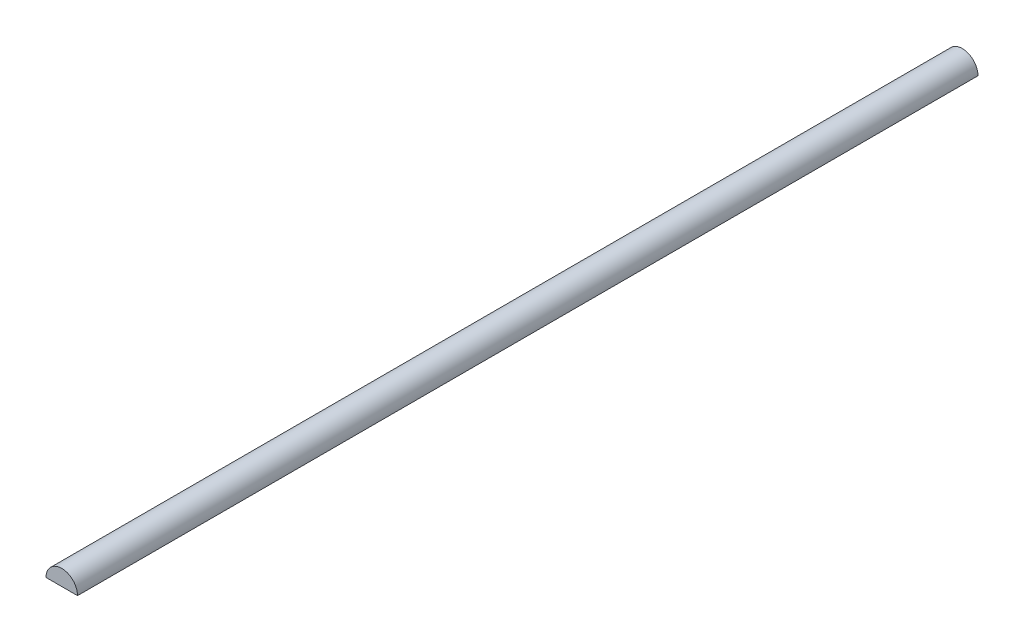
from build123d import *

# Parameters (mm, degrees)
RESSALTO_EXTRUS_O1_DEPTH = 200


with BuildPart() as part:
    # Esboço1 → Ressalto-extrusão1 (new body)
    with BuildSketch(Plane.XY):
        with BuildLine():
            Line((-3.5, -5.56506767), (3.5, -5.56506767))
            ThreePointArc((3.5, -5.56506767), (0, -2.06506767), (-3.5, -5.56506767))
        make_face()
    extrude(amount=-RESSALTO_EXTRUS_O1_DEPTH)


solid = part.part
